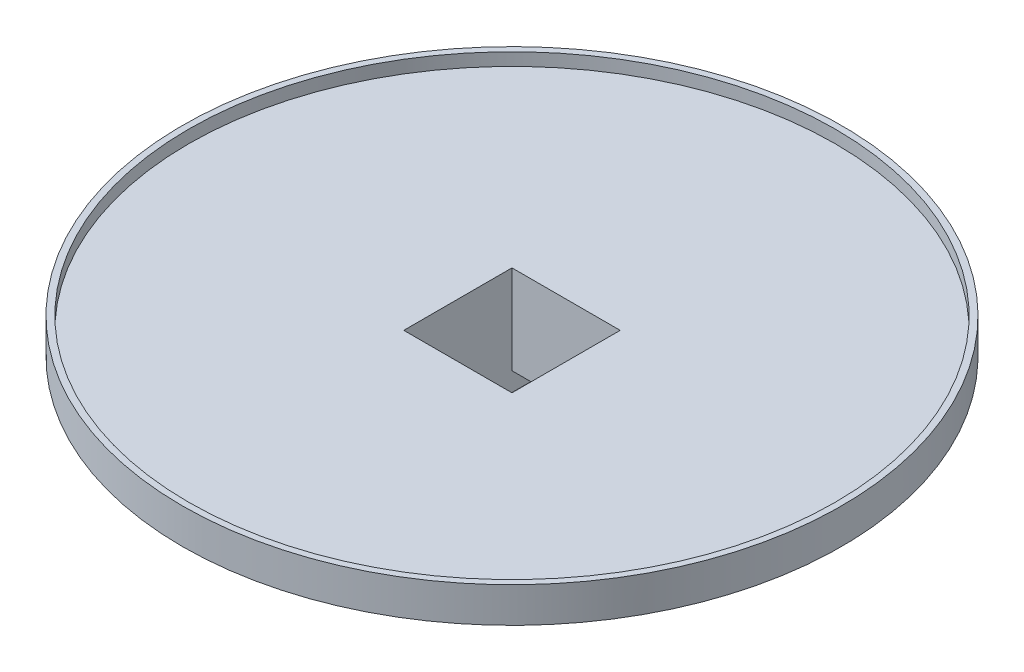
from build123d import *

# Parameters (mm, degrees)
SKETCH7_R             = 25.69
SKETCH7_W             = 8.6
SKETCH7_H             = 8.6
LENS_SPACER_DEPTH     = 7.08
SKETCH5_W             = 8.2
SKETCH5_H             = 24
SKETCH5_R             = 1.125
ATTACHMENT_LEGS_DEPTH = 1.5
LENS_START            = -7.08
SKETCH8_R             = 26.19
SKETCH8_R_2           = 25.69
LENS_POSITIONER_DEPTH = 8.09
SKETCH11_W            = 4
SKETCH11_H            = 3
NODE_HOLE_DEPTH       = 0.7


with BuildPart() as part:
    # Sketch7 → Lens Spacer (new body)
    with BuildSketch(Plane.XZ):
        with Locations(Location((0, 0, 0), (0, 0, 270))):
            Circle(SKETCH7_R)
        Rectangle(SKETCH7_W, SKETCH7_H, mode=Mode.SUBTRACT)
    extrude(amount=LENS_SPACER_DEPTH)

    # Sketch5 → Attachment Legs (add)
    # profile 1 of 2: a face of its own
    with BuildSketch(Plane(origin=(0, -7.08, 0), x_dir=(-1, 0, 0), z_dir=(0, -1, 0))):
        with Locations((-8.4, 2.1)):
            Rectangle(SKETCH5_W, SKETCH5_H)
        with Locations(Location((-10.75, 12.5, 0), (0, 0, 90))):
            Circle(SKETCH5_R, mode=Mode.SUBTRACT)
        with Locations(Location((-10.75, -0.3, 0), (0, 0, 90))):
            Circle(SKETCH5_R, mode=Mode.SUBTRACT)
    # profile 2 of 2: a face of its own
    with BuildSketch(Plane(origin=(0, -7.08, 0), x_dir=(-1, 0, 0), z_dir=(0, -1, 0))):
        with Locations((8.4, 2.1)):
            Rectangle(SKETCH5_W, SKETCH5_H)
        with Locations(Location((10.25, -0.3, 0), (0, 0, 270))):
            Circle(SKETCH5_R, mode=Mode.SUBTRACT)
        with Locations(Location((10.25, 12.5, 0), (0, 0, 270))):
            Circle(SKETCH5_R, mode=Mode.SUBTRACT)
    extrude(amount=ATTACHMENT_LEGS_DEPTH)

    # Sketch8 → Lens Positioner (add)
    with BuildSketch(Plane(origin=(0, 0, 0), x_dir=(1, 0, 0), z_dir=(0, 1, 0)).offset(LENS_START)):
        with Locations(Location((0, 0, 0), (0, 0, 270))):
            Circle(SKETCH8_R)
        with Locations(Location((0, 0, 0), (0, 0, 270))):
            Circle(SKETCH8_R_2, mode=Mode.SUBTRACT)
    extrude(amount=LENS_POSITIONER_DEPTH)

    # Sketch11 → Node Hole (cut)
    with BuildSketch(Plane.XZ.offset(8.58)):
        with Locations((7.9, -9.6)):
            Rectangle(SKETCH11_W, SKETCH11_H)
    extrude(amount=-NODE_HOLE_DEPTH, mode=Mode.SUBTRACT)

    # Sketch13 → Cut-Revolve1 (revolve, cut)
    with BuildSketch(Plane.XY, mode=Mode.PRIVATE) as cut_revolve1_sk:
        with BuildLine():
            Line((-7.7, -7.08), (-26.19, -7.08))
            Line((-26.19, -7.08), (-26.19, -1.79))
            ThreePointArc((-26.19, -1.79), (-18.616939408, -2.463282886), (-11.265314293, -4.401881538))
            ThreePointArc((-11.265314293, -4.401881538), (-9.27901976, -5.469843244), (-7.7, -7.08))
        make_face()
    revolve(cut_revolve1_sk.sketch.rotate(Axis((0, -81.156506397, 0), (0, 1, 0)), 270), axis=Axis((0, -81.156506397, 0), (0, 1, 0)), mode=Mode.SUBTRACT)


solid = part.part
